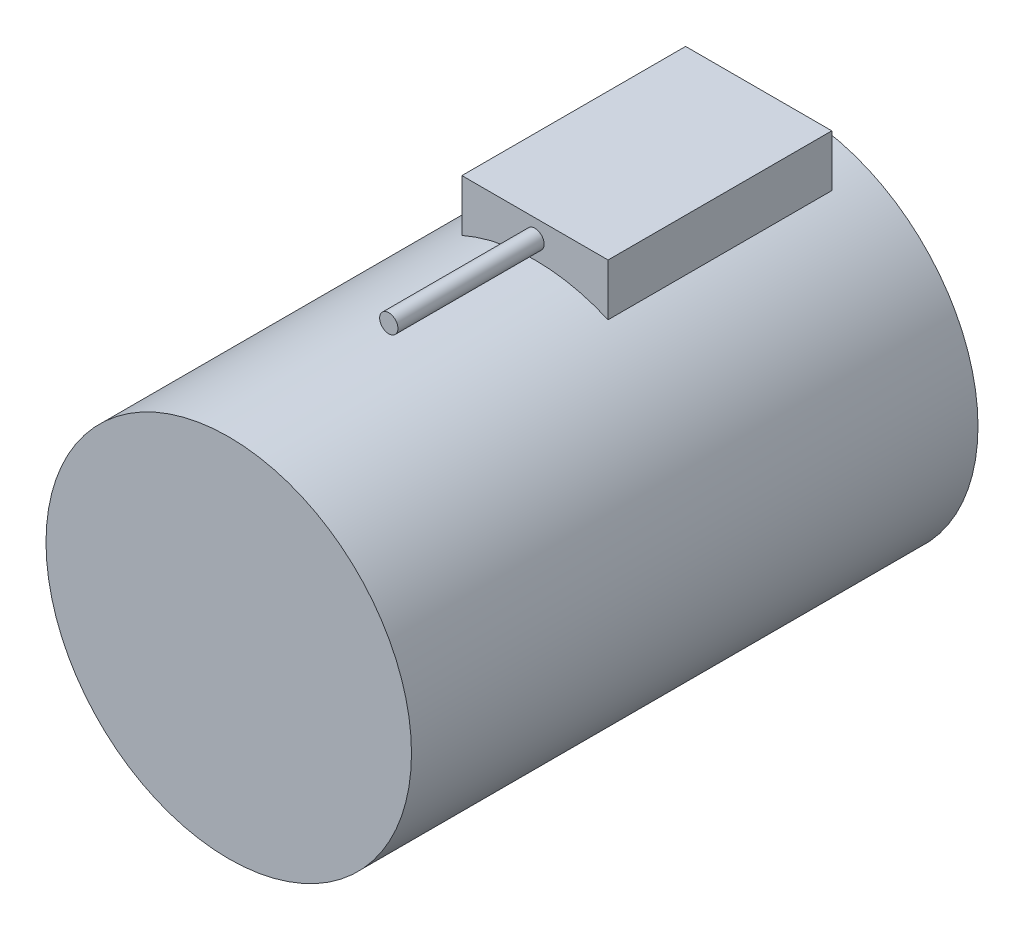
from build123d import *

# Parameters (mm, degrees)
SKETCH7_R           = 63.5
BOSS_EXTRUDE4_DEPTH = 196.85
SKETCH9_W           = 50.8
SKETCH9_H           = 77.739224187
BOSS_EXTRUDE5_DEPTH = 25.4
SKETCH10_R          = 3.175
BOSS_EXTRUDE6_DEPTH = 50.8


with BuildPart() as part:
    # Sketch7 → Boss-Extrude4 (new body)
    with BuildSketch(Plane.XY):
        Circle(SKETCH7_R)
    extrude(amount=BOSS_EXTRUDE4_DEPTH)

    # Sketch9 → Boss-Extrude5 (add)
    with BuildSketch(Plane(origin=(0, 50.8, 0), x_dir=(1, 0, 0), z_dir=(0, 1, 0))):
        with Locations((0, -51.569612094)):
            Rectangle(SKETCH9_W, SKETCH9_H)
    extrude(amount=BOSS_EXTRUDE5_DEPTH)

    # Sketch10 → Boss-Extrude6 (add)
    with BuildSketch(Plane.XY.offset(90.439224187)):
        with Locations(Location((0, 69.85, 0), (0, 0, 180))):
            Circle(SKETCH10_R)
    extrude(amount=BOSS_EXTRUDE6_DEPTH)


solid = part.part
